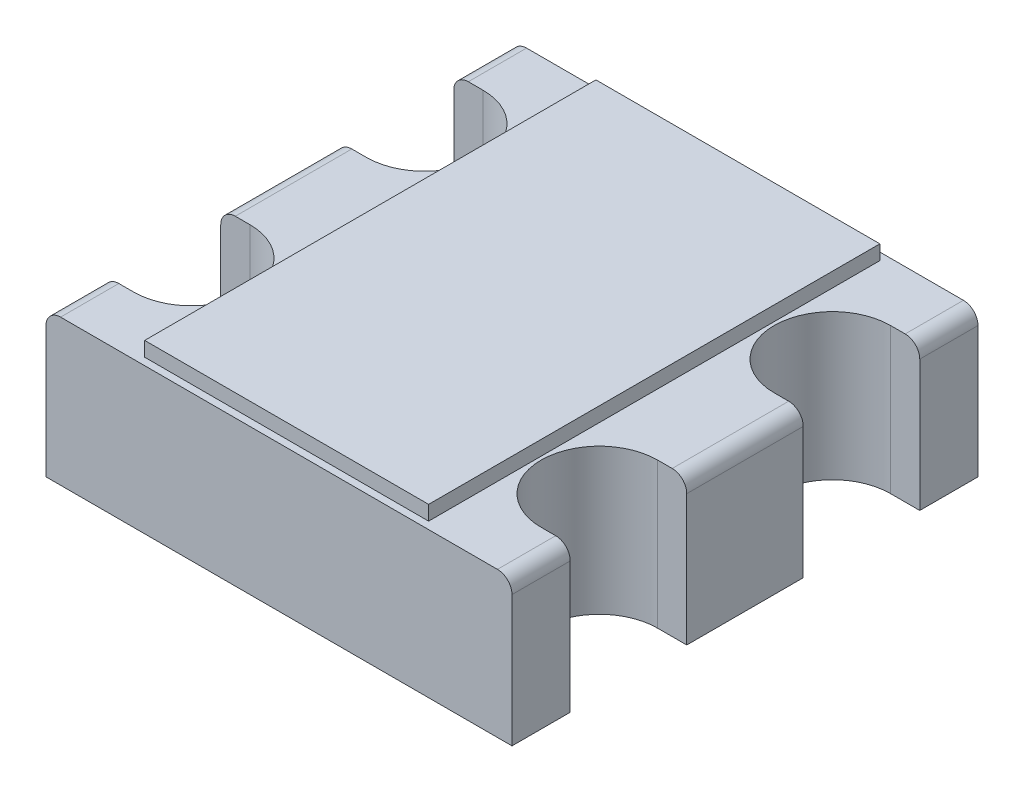
from build123d import *

# Parameters (mm, degrees)
BOSS_EXTRUDE1_DEPTH = 0.5
SKETCH2_W           = 0.974965632
SKETCH2_H           = 1.549329334
BOSS_EXTRUDE2_DEPTH = 0.05
FILLET2_R           = 0.05


with BuildPart() as part:
    # Sketch1 → Boss-Extrude1 (new body)
    with BuildSketch(Plane(origin=(0, 0, 0), x_dir=(1, 0, 0), z_dir=(0, 1, 0))):
        with BuildLine():
            Line((-0.8, 0.8), (-0.8, 0.6))
            Line((-0.8, 0.6), (-0.7, 0.6))
            ThreePointArc((-0.7, 0.6), (-0.5, 0.4), (-0.7, 0.2))
            Line((-0.7, 0.2), (-0.8, 0.2))
            Line((-0.8, 0.2), (-0.8, -0.2))
            Line((-0.8, -0.2), (-0.7, -0.2))
            ThreePointArc((-0.7, -0.2), (-0.5, -0.4), (-0.7, -0.6))
            Line((-0.7, -0.6), (-0.8, -0.6))
            Line((-0.8, -0.6), (-0.8, -0.8))
            Line((-0.8, -0.8), (0.8, -0.8))
            Line((0.8, -0.8), (0.8, -0.6))
            Line((0.8, -0.6), (0.7, -0.6))
            ThreePointArc((0.7, -0.6), (0.5, -0.4), (0.7, -0.2))
            Line((0.7, -0.2), (0.8, -0.2))
            Line((0.8, -0.2), (0.8, 0.2))
            Line((0.8, 0.2), (0.7, 0.2))
            ThreePointArc((0.7, 0.2), (0.5, 0.4), (0.7, 0.6))
            Line((0.7, 0.6), (0.8, 0.6))
            Line((0.8, 0.6), (0.8, 0.8))
            Line((0.8, 0.8), (-0.8, 0.8))
        make_face()
    extrude(amount=BOSS_EXTRUDE1_DEPTH)

    # Sketch2 → Boss-Extrude2 (add)
    with BuildSketch(Plane(origin=(0, 0.5, 0), x_dir=(1, 0, 0), z_dir=(0, 1, 0))):
        with Locations((0.001088626, -0.000183017)):
            Rectangle(SKETCH2_W, SKETCH2_H)
    extrude(amount=BOSS_EXTRUDE2_DEPTH)

    # Fillet2
    fillet2_edges = [part.edges().sort_by_distance(p)[0] for p in [
        (-0.8, 0.5, 0),
        (-0.8, 0.5, 0.7),
        (0.8, 0.5, 0.7),
        (0.8, 0.5, 0),
        (0.8, 0.5, -0.7),
        (-0.8, 0.5, -0.7),
    ]]
    fillet(fillet2_edges, radius=FILLET2_R)


solid = part.part
